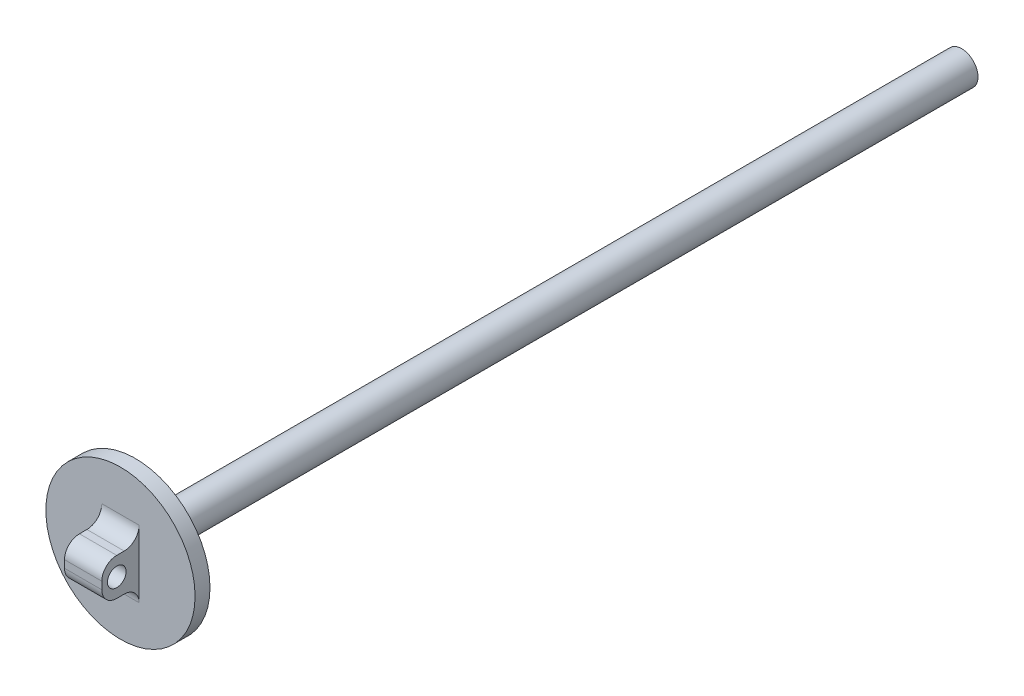
from build123d import *

# Parameters (mm, degrees)
SKETCH1_R           = 11.1125
BOSS_EXTRUDE1_DEPTH = 572.77
BOSS_EXTRUDE2_START = -25.4
SKETCH2_R           = 12.261678201
SKETCH2_R_2         = 11.1125
BOSS_EXTRUDE2_DEPTH = 25.4
SKETCH6_W           = 25.4
SKETCH6_H           = 25.4
BOSS_EXTRUDE3_DEPTH = 25.4
SKETCH7_R           = 6.35
CUT_EXTRUDE1_DEPTH  = 50.8
SKETCH8_R           = 50.8
BOSS_EXTRUDE4_DEPTH = 10.16
FILLET1_R           = 10.16


with BuildPart() as part:
    # Sketch1 → Boss-Extrude1 (new body)
    with BuildSketch(Plane.XY):
        Circle(SKETCH1_R)
    extrude(amount=BOSS_EXTRUDE1_DEPTH)

    # Sketch2 → Boss-Extrude2 (add)
    with BuildSketch(Plane.XY.offset(572.77).offset(BOSS_EXTRUDE2_START)):
        Circle(SKETCH2_R)
        Circle(SKETCH2_R_2, mode=Mode.SUBTRACT)
    extrude(amount=BOSS_EXTRUDE2_DEPTH)

    # Sketch6 → Boss-Extrude3 (add)
    with BuildSketch(Plane.XY.offset(572.77)):
        Rectangle(SKETCH6_W, SKETCH6_H)
    extrude(amount=BOSS_EXTRUDE3_DEPTH)

    # Sketch7 → Cut-Extrude1 (cut)
    with BuildSketch(Plane(origin=(12.7, 0, 0), x_dir=(0, 0, -1), z_dir=(1, 0, 0))):
        with Locations(Location((-588.01, 0, 0), (0, 0, 90))):
            Circle(SKETCH7_R)
    extrude(amount=-CUT_EXTRUDE1_DEPTH, mode=Mode.SUBTRACT)

    # Sketch8 → Boss-Extrude4 (add)
    with BuildSketch(Plane.XY.offset(572.77)):
        Circle(SKETCH8_R)
    extrude(amount=-BOSS_EXTRUDE4_DEPTH)

    # Fillet1
    fillet1_edges = [part.edges().sort_by_distance(p)[0] for p in [
        (0, 12.7, 572.77),
        (0, -12.7, 572.77),
        (0, 12.7, 598.17),
        (0, -12.7, 598.17),
    ]]
    fillet(fillet1_edges, radius=FILLET1_R)


solid = part.part
